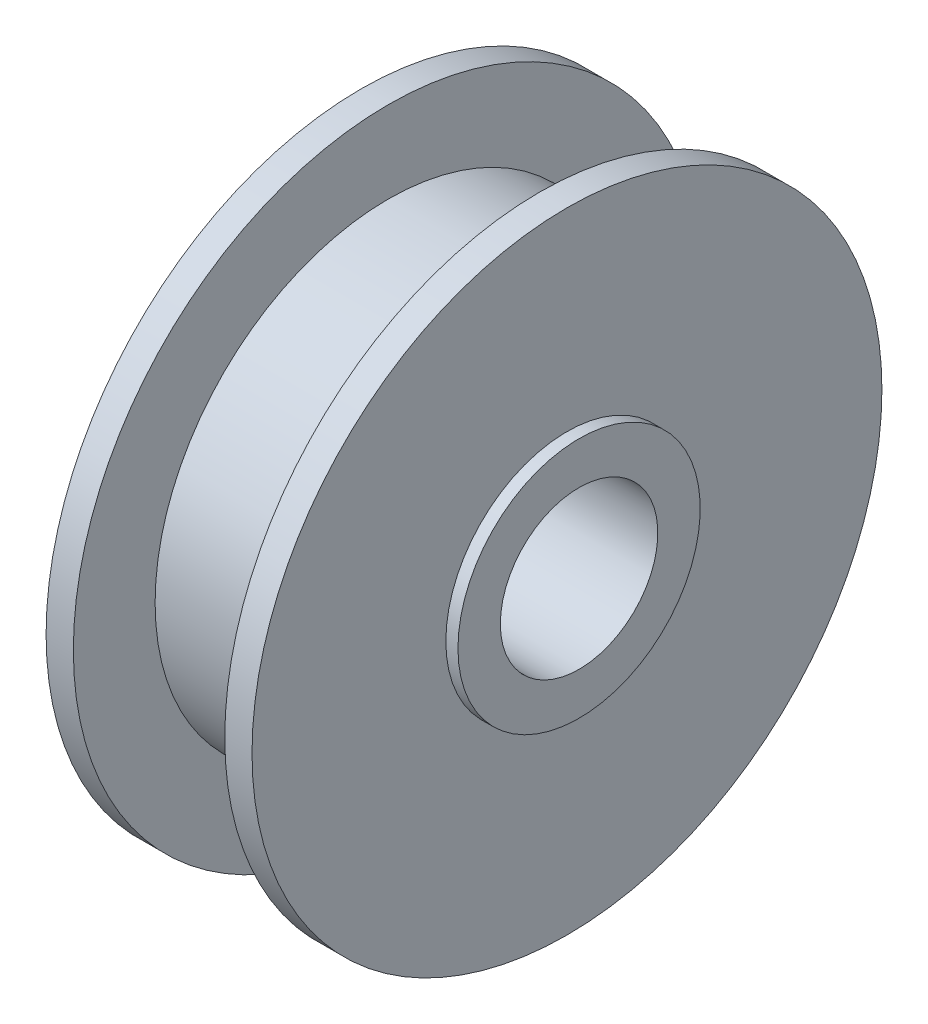
from build123d import *


with BuildPart() as part:
    # Sketch1 → Revolve1 (revolve)
    with BuildSketch(Plane.XY, mode=Mode.PRIVATE) as revolve1_sk:
        Polygon((-1.9, 1.3), (-1.9, 2), (-1.7, 2), (-1.7, 5.2), (-1.25, 5.2), (-1.25, 3.85), (1.25, 3.85), (1.25, 5.2), (1.7, 5.2), (1.7, 2), (1.9, 2), (1.9, 1.3), align=None)
    revolve(revolve1_sk.sketch.rotate(Axis((-1.9, 0, 0), (1, 0, 0)), 90), axis=Axis((-1.9, 0, 0), (1, 0, 0)))


solid = part.part
